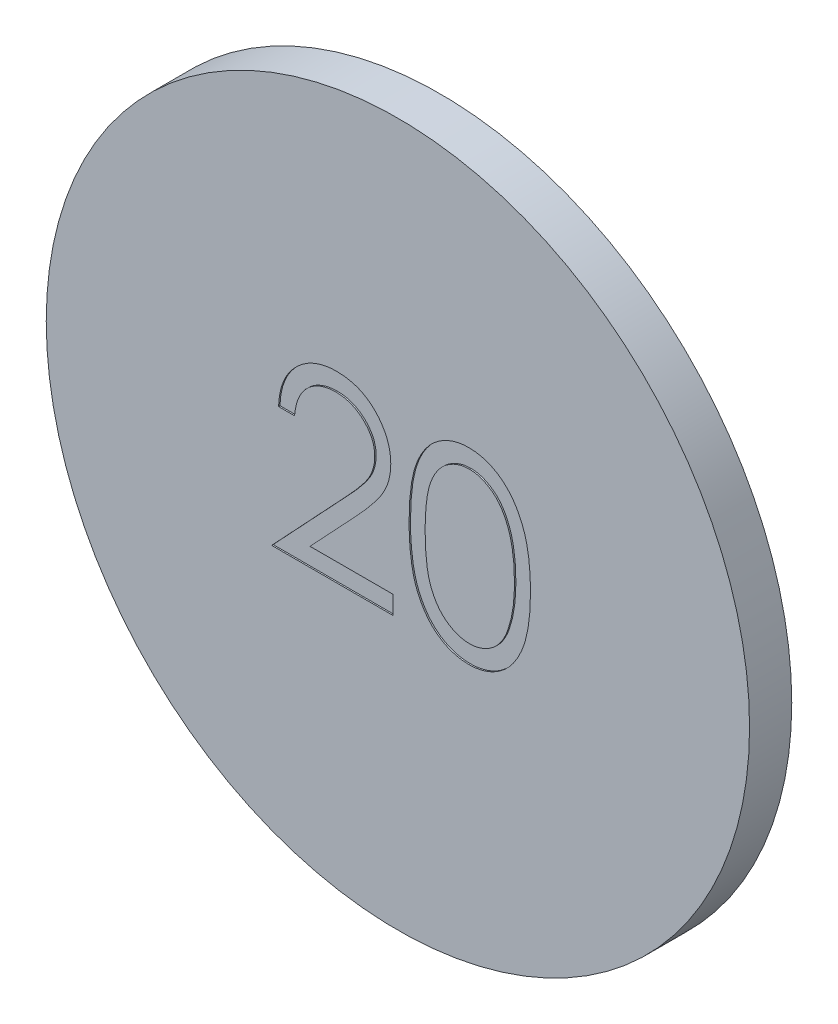
from build123d import *

# Parameters (mm, degrees)
SKETCH1_R           = 25
BOSS_EXTRUDE1_DEPTH = 3
CUT_EXTRUDE2_DEPTH  = 0.1


with BuildPart() as part:
    # Sketch1 → Boss-Extrude1 (new body)
    with BuildSketch(Plane(origin=(0, 0, 0), x_dir=(0, 1, 0), z_dir=(0, 0, 1))):
        with Locations(Location((0, 0, 0), (0, 0, 270))):
            Circle(SKETCH1_R)
    extrude(amount=BOSS_EXTRUDE1_DEPTH)

    # Sketch5 → Cut-Extrude2 (cut)
    # profile 1 of 2: a face of its own
    with BuildSketch(Plane.XY.offset(3)):
        with BuildLine():
            Line((-7.344276046, 3.001268025), (-8.484019636, 3.001268025))
            add(Edge.make_bspline(
                [(-8.484019636, 3.001268025), (-8.476591395, 3.152473817), (-8.462002528, 3.44943797), (-8.393682735, 3.882413288), (-8.295925838, 4.296269272), (-8.157708276, 4.687682959), (-7.986054068, 5.060115203), (-7.780205112, 5.412086688), (-7.536387426, 5.742254716), (-7.259865848, 6.047558519), (-6.959533929, 6.327639133), (-6.635480949, 6.569502442), (-6.294957564, 6.773855136), (-5.938996888, 6.944692785), (-5.563582843, 7.07292594), (-5.172122187, 7.168073032), (-4.762895035, 7.225318629), (-4.484075526, 7.231471909), (-4.342272841, 7.234601358)],
                knots=[0, 0, 0, 0, 1.10065271, 2.161652631, 3.183658789, 4.190468796, 5.17591951, 6.163126047, 7.15150782, 8.156236427, 9.156009102, 10.134482811, 11.092018607, 12.041330605, 13.001268258, 13.972401359, 14.968799086, 16, 16, 16, 16], degree=3))
            add(Edge.make_bspline(
                [(-4.342272841, 7.234601358), (-4.203015258, 7.231341245), (-3.929379082, 7.224935238), (-3.530011201, 7.169922361), (-3.149819304, 7.083759785), (-2.789546551, 6.962872417), (-2.452067402, 6.800368924), (-2.134846641, 6.605160712), (-1.834107699, 6.37939161), (-1.563391655, 6.113584915), (-1.314805196, 5.829821977), (-1.100348442, 5.526880155), (-0.916694963, 5.213991033), (-0.763613953, 4.888768702), (-0.650924535, 4.54815097), (-0.565369323, 4.197096834), (-0.51700985, 3.83197252), (-0.509587885, 3.584843018), (-0.505814508, 3.459200717)],
                knots=[0, 0, 0, 0, 1.111607364, 2.184268762, 3.212621178, 4.221274766, 5.211760367, 6.196651075, 7.1921475, 8.207485113, 9.220403448, 10.201281604, 11.166441695, 12.114753415, 13.065576456, 14.026450734, 14.996634279, 16, 16, 16, 16], degree=3))
            add(Edge.make_bspline(
                [(-0.505814508, 3.459200717), (-0.51193462, 3.282308552), (-0.524067444, 2.931628429), (-0.628772422, 2.415629761), (-0.790541745, 1.915231403), (-0.986749594, 1.512535984), (-1.184944225, 1.189676973), (-1.359768055, 0.921468789), (-1.568963735, 0.635441506), (-1.810617206, 0.328714339), (-2.08108296, 0.000349054), (-2.382307612, -0.349789097), (-2.71659226, -0.717981348), (-2.951209091, -0.96946244), (-3.072781655, -1.099773642)],
                knots=[0, 0, 0, 0, 1.184203166, 2.347625244, 3.513805382, 4.700623107, 5.337941753, 6.051866363, 6.845199593, 7.711357327, 8.668078039, 9.695487809, 10.805859518, 12, 12, 12, 12], degree=3))
            Line((-3.072781655, -1.099773642), (-6.250325726, -4.488475565))
            Line((-6.250325726, -4.488475565), (-0.342993995, -4.488475565))
            Line((-0.342993995, -4.488475565), (-0.342993995, -5.791039668))
            Line((-0.342993995, -5.791039668), (-8.972481175, -5.791039668))
            Line((-8.972481175, -5.791039668), (-4.047160662, -0.534989988))
            add(Edge.make_bspline(
                [(-4.047160662, -0.534989988), (-3.927244044, -0.409810419), (-3.696908763, -0.169366085), (-3.37112627, 0.181672657), (-3.078521941, 0.507335276), (-2.817201687, 0.807006466), (-2.592834396, 1.085069583), (-2.393726583, 1.332518936), (-2.234194296, 1.560227942), (-2.061055574, 1.824172455), (-1.893364842, 2.146434292), (-1.749265721, 2.540256536), (-1.661400414, 2.945666852), (-1.650860011, 3.219631387), (-1.645558098, 3.357437896)],
                knots=[0, 0, 0, 0, 1.329631726, 2.553950428, 3.673215718, 4.687767853, 5.603093632, 6.413772471, 7.123043292, 7.734684054, 8.834405432, 9.900288307, 10.943827018, 12, 12, 12, 12], degree=3))
            add(Edge.make_bspline(
                [(-1.645558098, 3.357437896), (-1.647864934, 3.444093256), (-1.652411265, 3.61487433), (-1.692534911, 3.865266656), (-1.753170176, 4.106801838), (-1.840057255, 4.340222827), (-1.954744569, 4.563182764), (-2.094347976, 4.77595305), (-2.255420492, 4.981653009), (-2.44175224, 5.174523548), (-2.646445469, 5.351166779), (-2.862687461, 5.507645603), (-3.091469268, 5.638416091), (-3.331826282, 5.745616781), (-3.583088414, 5.829710307), (-3.845741632, 5.887980009), (-4.119060206, 5.924565023), (-4.305690319, 5.929515018), (-4.400786463, 5.932037255)],
                knots=[0, 0, 0, 0, 0.991446411, 1.95395049, 2.89581595, 3.838931463, 4.798493298, 5.75982156, 6.748411868, 7.785213223, 8.824556874, 9.840280684, 10.836137867, 11.835679398, 12.848801643, 13.863922112, 14.911575587, 16, 16, 16, 16], degree=3))
            add(Edge.make_bspline(
                [(-4.400786463, 5.932037255), (-4.500103485, 5.92944271), (-4.695145717, 5.92434745), (-4.981509065, 5.888705213), (-5.254688886, 5.82721602), (-5.515372363, 5.743117802), (-5.764000574, 5.636225353), (-5.999364391, 5.503086737), (-6.220935446, 5.344215204), (-6.429130259, 5.1640909), (-6.620950983, 4.963548461), (-6.78948679, 4.73999231), (-6.936748784, 4.49750426), (-7.065233717, 4.236738605), (-7.169575793, 3.955329174), (-7.249306939, 3.654274931), (-7.312396354, 3.334883061), (-7.333472986, 3.114320039), (-7.344276046, 3.001268025)],
                knots=[0, 0, 0, 0, 1.031018746, 2.02475058, 2.990194455, 3.934040569, 4.864654155, 5.795059489, 6.735614925, 7.690564532, 8.649604399, 9.611025574, 10.590972636, 11.591080095, 12.624614302, 13.701020113, 14.821632451, 16, 16, 16, 16], degree=3))
        make_face()
    # profile 2 of 2: a face of its own
    with BuildSketch(Plane.XY.offset(3)):
        with BuildLine():
            add(Edge.make_bspline(
                [(0.796749595, 0.553872191), (0.797939832, 0.75742557), (0.800251885, 1.152830941), (0.825972727, 1.728992356), (0.868700398, 2.269505405), (0.927256008, 2.774395959), (0.998513822, 3.243794362), (1.093638587, 3.676446195), (1.201816471, 4.07435391), (1.327192489, 4.438815058), (1.468662466, 4.774739866), (1.622638212, 5.088339882), (1.795230466, 5.379140608), (1.976575264, 5.651783447), (2.174013353, 5.901805425), (2.381926107, 6.132737372), (2.608428344, 6.339242095), (2.845820402, 6.527370107), (3.096251573, 6.692286761), (3.352583533, 6.837548413), (3.616580631, 6.961645074), (3.888963638, 7.059218941), (4.167284348, 7.139812585), (4.452515704, 7.194926767), (4.745128653, 7.229604692), (4.942637002, 7.23292), (5.042803281, 7.234601358)],
                knots=[0, 0, 0, 0, 1.646270934, 3.197905019, 4.663502075, 6.030701355, 7.308322542, 8.50163776, 9.611534131, 10.641858119, 11.616356847, 12.558055219, 13.465016945, 14.349605745, 15.204443733, 16.039544428, 16.859896111, 17.680448484, 18.487036065, 19.28249412, 20.06191084, 20.843045899, 21.620316918, 22.403196591, 23.190181807, 24, 24, 24, 24], degree=3))
            add(Edge.make_bspline(
                [(5.042803281, 7.234601358), (5.143806303, 7.232831286), (5.344669535, 7.229311169), (5.641633182, 7.195478577), (5.931736313, 7.139340502), (6.21374213, 7.05979868), (6.489967081, 6.961117225), (6.758250618, 6.837429686), (7.020259171, 6.693452081), (7.271829072, 6.524274012), (7.515722104, 6.33565261), (7.74594757, 6.122428069), (7.962526425, 5.886753373), (8.168176818, 5.631150039), (8.357064271, 5.350715588), (8.536945011, 5.050327532), (8.697952113, 4.72473268), (8.853017934, 4.379363554), (8.986865, 4.004663992), (9.107573947, 3.602746147), (9.205106205, 3.168862669), (9.286347279, 2.705290007), (9.349284472, 2.210325711), (9.395122917, 1.685030795), (9.419336682, 1.129059663), (9.423896712, 0.748938324), (9.426236774, 0.553872191)],
                knots=[0, 0, 0, 0, 0.810914788, 1.612654377, 2.396697861, 3.181598691, 3.963628158, 4.749916497, 5.551656086, 6.361998678, 7.18212741, 8.025565596, 8.878627764, 9.750805457, 10.657531673, 11.591944965, 12.560506719, 13.57287815, 14.630710178, 15.753379473, 16.941251878, 18.199788006, 19.531962791, 20.947069417, 22.433333509, 24, 24, 24, 24], degree=3))
            add(Edge.make_bspline(
                [(9.426236774, 0.553872191), (9.423872453, 0.359656868), (9.41926567, -0.018763769), (9.395394363, -0.572233308), (9.348373044, -1.094740493), (9.289553943, -1.587538457), (9.20808902, -2.048576103), (9.107921703, -2.479448816), (8.996704817, -2.882017304), (8.859418564, -3.252983621), (8.709156844, -3.597522729), (8.545670846, -3.91925781), (8.370520335, -4.221032644), (8.179698317, -4.500431726), (7.976304503, -4.759434281), (7.75598567, -4.993468512), (7.524952404, -5.208173522), (7.280341638, -5.399223713), (7.024848295, -5.566445718), (6.763739644, -5.715993118), (6.492382796, -5.836580326), (6.216927225, -5.94012176), (5.933432868, -6.019226257), (5.642253107, -6.073922819), (5.344869051, -6.112283526), (5.143840515, -6.115209896), (5.042803281, -6.116680693)],
                knots=[0, 0, 0, 0, 1.561518951, 3.042555995, 4.452378317, 5.7783523, 7.031515105, 8.214008947, 9.334062868, 10.386615937, 11.391082383, 12.354592575, 13.286541444, 14.194233754, 15.072674879, 15.931287219, 16.775624067, 17.606195743, 18.42308326, 19.229000347, 20.022332153, 20.807536673, 21.593273796, 22.3848459, 23.188221202, 24, 24, 24, 24], degree=3))
            add(Edge.make_bspline(
                [(5.042803281, -6.116680693), (4.942639781, -6.114988489), (4.745136911, -6.111651793), (4.452483825, -6.077130539), (4.168430387, -6.021629713), (3.891574908, -5.943918035), (3.620496982, -5.848795629), (3.358890456, -5.724866549), (3.103846575, -5.58214007), (2.856045786, -5.419596684), (2.620144516, -5.23337229), (2.394815291, -5.027399014), (2.185718793, -4.796536922), (1.991103647, -4.544431315), (1.806140527, -4.27340155), (1.635999086, -3.979747168), (1.478624844, -3.664632553), (1.334775607, -3.326021848), (1.207236171, -2.958973967), (1.094577344, -2.559289805), (1.005625973, -2.12344164), (0.92948782, -1.654930051), (0.868076488, -1.151741789), (0.826150793, -0.61360368), (0.800238021, -0.040851064), (0.797933623, 0.352013545), (0.796749595, 0.553872191)],
                knots=[0, 0, 0, 0, 0.810891512, 1.598919785, 2.382837074, 3.152667961, 3.926044502, 4.706494248, 5.493654104, 6.291793342, 7.103789334, 7.925228297, 8.761435821, 9.622817696, 10.50288917, 11.416980706, 12.369136599, 13.353924996, 14.394355917, 15.514179734, 16.714354668, 17.994756427, 19.357759367, 20.818452758, 22.365282078, 24, 24, 24, 24], degree=3))
        make_face()
        with BuildLine():
            add(Edge.make_bspline(
                [(1.936493184, 0.558960332), (1.936926607, 0.389329339), (1.937767794, 0.060108891), (1.95974315, -0.418293799), (1.989679707, -0.86450042), (2.028292413, -1.279077538), (2.085634541, -1.660621869), (2.149884885, -2.011757577), (2.228073668, -2.330626408), (2.320584161, -2.619416464), (2.425954598, -2.883028799), (2.541001589, -3.128324636), (2.664593355, -3.358201663), (2.802911416, -3.570595042), (2.953551788, -3.766197409), (3.1131119, -3.948470829), (3.287546706, -4.111019875), (3.528860286, -4.305971606), (3.847436064, -4.507426749), (4.248830288, -4.682853989), (4.661284381, -4.793098902), (4.941233203, -4.807118817), (5.080964338, -4.814116591)],
                knots=[0, 0, 0, 0, 1.459021318, 2.831673884, 4.118529203, 5.306027144, 6.411944654, 7.436330062, 8.375795394, 9.233974572, 10.042671642, 10.816086306, 11.563610507, 12.285937304, 12.993564865, 13.685989202, 14.367179055, 15.041617293, 16.353048772, 17.594441528, 18.799311195, 20, 20, 20, 20], degree=3))
            add(Edge.make_bspline(
                [(5.080964338, -4.814116591), (5.221599318, -4.808318929), (5.50257892, -4.796735575), (5.913092976, -4.684980157), (6.311619956, -4.516362114), (6.62393814, -4.316981166), (6.861546226, -4.127104084), (7.031787876, -3.965216646), (7.188041594, -3.783948213), (7.33623998, -3.588370768), (7.472162912, -3.374747754), (7.59576344, -3.14410641), (7.708551587, -2.89580625), (7.772810125, -2.722470339), (7.805663858, -2.633848161)],
                knots=[0, 0, 0, 0, 1.353760809, 2.704726607, 4.075137775, 5.516104923, 6.260822281, 7.007110065, 7.778089737, 8.566572457, 9.372053459, 10.217411131, 11.088608312, 12, 12, 12, 12], degree=3))
            add(Edge.make_bspline(
                [(7.805663858, -2.633848161), (7.843951701, -2.520528821), (7.921692442, -2.290441962), (8.021883737, -1.933522425), (8.100788472, -1.559043824), (8.171775542, -1.169244115), (8.220228059, -0.761248628), (8.259227267, -0.336319749), (8.282198617, 0.105862908), (8.285046142, 0.406290447), (8.286493184, 0.558960332)],
                knots=[0, 0, 0, 0, 0.884706709, 1.796334032, 2.740027952, 3.714592787, 4.726048262, 5.777819803, 6.87074269, 8, 8, 8, 8], degree=3))
            add(Edge.make_bspline(
                [(8.286493184, 0.558960332), (8.284496783, 0.711605524), (8.280591396, 1.01021215), (8.265663498, 1.447520977), (8.227115099, 1.862875424), (8.184301154, 2.258064854), (8.121174094, 2.630901666), (8.053110052, 2.98450706), (7.961665653, 3.314500321), (7.863985327, 3.626047946), (7.752187606, 3.915610321), (7.629121942, 4.184537489), (7.497688703, 4.434127776), (7.354932573, 4.663696392), (7.202548238, 4.874271619), (7.036513702, 5.061631434), (6.863414978, 5.231582718), (6.620964046, 5.425575469), (6.303557338, 5.62337505), (5.908603131, 5.805405093), (5.497592508, 5.90993804), (5.21974026, 5.924676162), (5.080964338, 5.932037255)],
                knots=[0, 0, 0, 0, 1.31362396, 2.569729283, 3.763502607, 4.902122613, 5.988968491, 7.01645872, 7.998833611, 8.933434873, 9.825090667, 10.667526885, 11.477055099, 12.250526234, 12.991942729, 13.710640831, 14.402115721, 15.076753259, 16.378508321, 17.609869233, 18.806226677, 20, 20, 20, 20], degree=3))
            add(Edge.make_bspline(
                [(5.080964338, 5.932037255), (4.94050019, 5.924666006), (4.659316001, 5.909910079), (4.244033422, 5.805794559), (3.845963346, 5.624318939), (3.529395981, 5.424920331), (3.286775956, 5.235007029), (3.11593304, 5.070319039), (2.955745501, 4.890174059), (2.808179846, 4.692772825), (2.669970161, 4.480627063), (2.543039058, 4.252067831), (2.428676176, 4.005936881), (2.323140859, 3.742442958), (2.230348171, 3.453677817), (2.153807219, 3.135201755), (2.083097055, 2.78518289), (2.033039936, 2.401572104), (1.988540023, 1.986891148), (1.959941989, 1.539570593), (1.937694283, 1.060365556), (1.936901569, 0.729442895), (1.936493184, 0.558960332)],
                knots=[0, 0, 0, 0, 1.207732386, 2.417664972, 3.655092373, 4.956220595, 5.625982001, 6.301752483, 6.994047911, 7.697131622, 8.419323945, 9.170223765, 9.943494443, 10.752040957, 11.610060368, 12.549350801, 13.567764191, 14.679664412, 15.874934091, 17.154273443, 18.533957287, 20, 20, 20, 20], degree=3))
        make_face(mode=Mode.SUBTRACT)
    extrude(amount=-CUT_EXTRUDE2_DEPTH, mode=Mode.SUBTRACT)


solid = part.part
